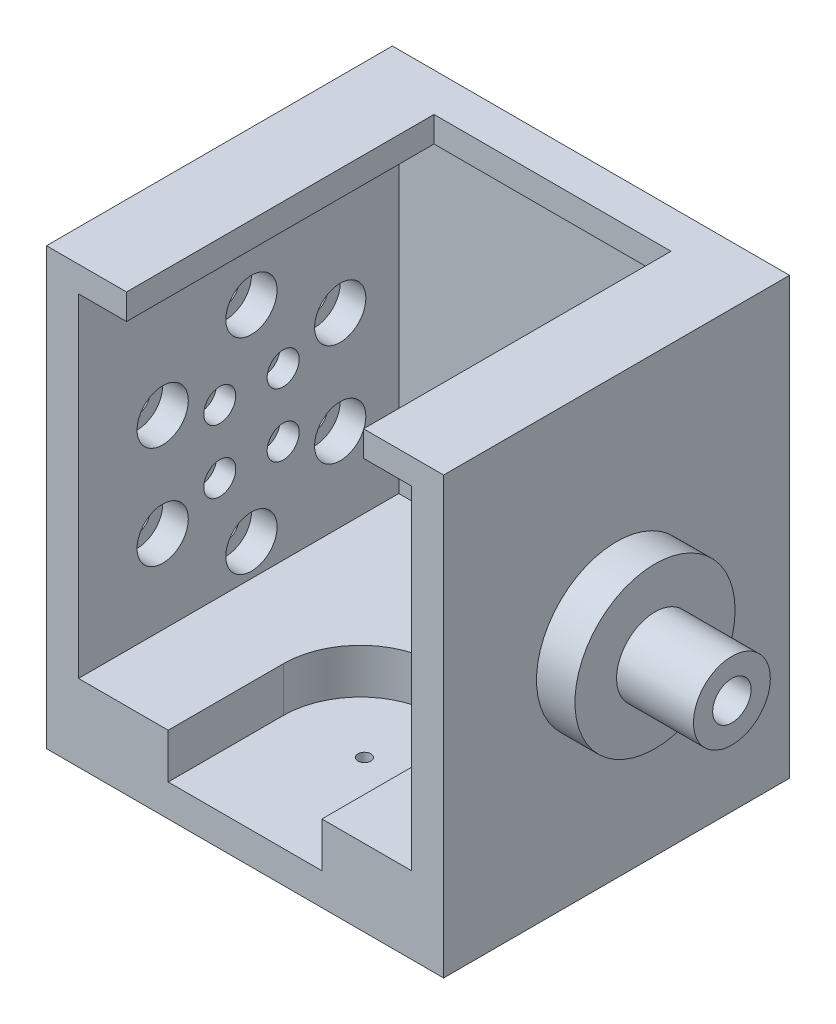
from build123d import *

# Parameters (mm, degrees)
SKETCH1_W           = 62
SKETCH1_H           = 54
BOSS_EXTRUDE1_DEPTH = 12
BOSS_EXTRUDE2_DEPTH = 52
SKETCH3_W           = 62
SKETCH3_H           = 54
BOSS_EXTRUDE3_DEPTH = 4
CUT_EXTRUDE1_DEPTH  = 7
SKETCH6_R           = 20
BOSS_EXTRUDE4_DEPTH = 6
SKETCH16_R          = 2
CUT_EXTRUDE3_DEPTH  = 11
SKETCH26_W          = 37
SKETCH26_H          = 4
CUT_EXTRUDE10_DEPTH = 48
SKETCH29_R          = 1
CUT_EXTRUDE12_DEPTH = 48
SKETCH31_R          = 12.5
BOSS_EXTRUDE7_DEPTH = 6
SKETCH33_R          = 6
SKETCH33_R_2        = 3
BOSS_EXTRUDE8_DEPTH = 12
SKETCH34_R          = 1
CUT_EXTRUDE13_DEPTH = 11
SKETCH35_R          = 2.5
CUT_EXTRUDE15_DEPTH = 3
SKETCH37_R          = 4
CUT_EXTRUDE16_DEPTH = 4
BOSS_EXTRUDE9_DEPTH = 10


with BuildPart() as part:
    # Sketch1 → Boss-Extrude1 (new body)
    with BuildSketch(Plane(origin=(0, 0, 0), x_dir=(1, 0, 0), z_dir=(0, 1, 0))):
        Rectangle(SKETCH1_W, SKETCH1_H)
    extrude(amount=BOSS_EXTRUDE1_DEPTH)

    # Sketch2 → Boss-Extrude2 (add)
    with BuildSketch(Plane(origin=(0, 12, 0), x_dir=(1, 0, 0), z_dir=(0, 1, 0))):
        Polygon((-31, -27), (-26, -27), (-26, 23), (26, 23), (26, -27), (31, -27), (31, 22.851296476), (31, 27), (-31, 27), (-31, 22.851296476), align=None)
    extrude(amount=BOSS_EXTRUDE2_DEPTH)

    # Sketch3 → Boss-Extrude3 (add)
    with BuildSketch(Plane(origin=(0, 64, 0), x_dir=(1, 0, 0), z_dir=(0, 1, 0))):
        Rectangle(SKETCH3_W, SKETCH3_H)
    extrude(amount=BOSS_EXTRUDE3_DEPTH)

    # Sketch9 → Ø20.0mm Dowel Hole1 (revolve, cut)
    with BuildSketch(Plane(origin=(0, 25, -23), x_dir=(0, -1, 0), z_dir=(1, 0, 0))):
        Polygon((0, 0), (0, 4), (10, 4), (10, 0.025), (10.025, 0), align=None)
    revolve(axis=Axis((0, 25, -16.65), (0, 0, -1)), mode=Mode.SUBTRACT)

    # Sketch14 → Cut-Extrude1 (cut)
    with BuildSketch(Plane(origin=(0, 12, 0), x_dir=(1, 0, 0), z_dir=(0, 1, 0))):
        with BuildLine():
            Line((-12, -9), (-12, -27))
            Line((-12, -27), (12, -27))
            Line((12, -27), (12, -9))
            ThreePointArc((12, -9), (0, 3), (-12, -9))
        make_face()
    extrude(amount=-CUT_EXTRUDE1_DEPTH, mode=Mode.SUBTRACT)

    # Sketch6 → Boss-Extrude4 (add)
    with BuildSketch(Plane.ZY.offset(31)):
        with Locations((0, 33)):
            Circle(SKETCH6_R)
    extrude(amount=BOSS_EXTRUDE4_DEPTH)

    # Sketch16 → Cut-Extrude3 (cut)
    with BuildSketch(Plane.ZY.offset(37)):
        with Locations((0, 49)):
            Circle(SKETCH16_R)
        with Locations((13.856406461, 41)):
            Circle(SKETCH16_R)
        with Locations((13.856406461, 25)):
            Circle(SKETCH16_R)
        with Locations((0, 17)):
            Circle(SKETCH16_R)
        with Locations((-13.856406461, 25)):
            Circle(SKETCH16_R)
        with Locations((-13.856406461, 41)):
            Circle(SKETCH16_R)
    extrude(amount=-CUT_EXTRUDE3_DEPTH, mode=Mode.SUBTRACT)

    # Sketch26 → Cut-Extrude10 (cut)
    with BuildSketch(Plane.XY.offset(27)):
        with Locations((0, 66)):
            Rectangle(SKETCH26_W, SKETCH26_H)
    extrude(amount=-CUT_EXTRUDE10_DEPTH, mode=Mode.SUBTRACT)

    # Sketch29 → Cut-Extrude12 (cut)
    with BuildSketch(Plane(origin=(0, 5, 0), x_dir=(1, 0, 0), z_dir=(0, 1, 0))):
        with Locations(Location((0, -8.367265469, 0), (0, 0, 270))):
            Circle(SKETCH29_R)
    extrude(amount=-CUT_EXTRUDE12_DEPTH, mode=Mode.SUBTRACT)

    # Sketch31 → Boss-Extrude7 (add)
    with BuildSketch(Plane(origin=(31, 0, 0), x_dir=(0, 0, -1), z_dir=(1, 0, 0))):
        with Locations((0, 33)):
            Circle(SKETCH31_R)
    extrude(amount=BOSS_EXTRUDE7_DEPTH)

    # Sketch33 → Boss-Extrude8 (add)
    with BuildSketch(Plane(origin=(37, 0, 0), x_dir=(0, 0, -1), z_dir=(1, 0, 0))):
        with Locations((0, 33)):
            Circle(SKETCH33_R)
        with Locations((0, 33)):
            Circle(SKETCH33_R_2, mode=Mode.SUBTRACT)
    extrude(amount=BOSS_EXTRUDE8_DEPTH)

    # Sketch34 → Cut-Extrude13 (cut)
    with BuildSketch(Plane.ZY.offset(37)):
        with Locations((-4.949747468, 37.949747468)):
            Circle(SKETCH34_R)
        with Locations((4.949747468, 37.949747468)):
            Circle(SKETCH34_R)
        with Locations((4.949747468, 28.050252532)):
            Circle(SKETCH34_R)
        with Locations((-4.949747468, 28.050252532)):
            Circle(SKETCH34_R)
    extrude(amount=-CUT_EXTRUDE13_DEPTH, mode=Mode.SUBTRACT)

    # Sketch35 → Cut-Extrude15 (cut)
    with BuildSketch(Plane(origin=(-26, 0, 0), x_dir=(0, 0, -1), z_dir=(1, 0, 0))):
        with Locations((-4.949747468, 37.949747468)):
            Circle(SKETCH35_R)
        with Locations((4.949747468, 37.949747468)):
            Circle(SKETCH35_R)
        with Locations((4.949747468, 28.050252532)):
            Circle(SKETCH35_R)
        with Locations((-4.949747468, 28.050252532)):
            Circle(SKETCH35_R)
    extrude(amount=-CUT_EXTRUDE15_DEPTH, mode=Mode.SUBTRACT)

    # Sketch37 → Cut-Extrude16 (cut)
    with BuildSketch(Plane(origin=(-26, 0, 0), x_dir=(0, 0, -1), z_dir=(1, 0, 0))):
        with Locations((0, 49)):
            Circle(SKETCH37_R)
        with Locations((13.856406461, 41)):
            Circle(SKETCH37_R)
        with Locations((13.856406461, 25)):
            Circle(SKETCH37_R)
        with Locations((0, 17)):
            Circle(SKETCH37_R)
        with Locations((-13.856406461, 25)):
            Circle(SKETCH37_R)
        with Locations((-13.856406461, 41)):
            Circle(SKETCH37_R)
    extrude(amount=-CUT_EXTRUDE16_DEPTH, mode=Mode.SUBTRACT)

    # Sketch38 → Boss-Extrude9 (add)
    with BuildSketch(Plane(origin=(37, 0, 0), x_dir=(0, 0, -1), z_dir=(1, 0, 0))):
        with BuildLine():
            Line((1.658312395, 35.5), (-1.658312395, 35.5))
            ThreePointArc((-1.658312395, 35.5), (0, 36), (1.658312395, 35.5))
        make_face()
    extrude(amount=BOSS_EXTRUDE9_DEPTH)


solid = part.part
